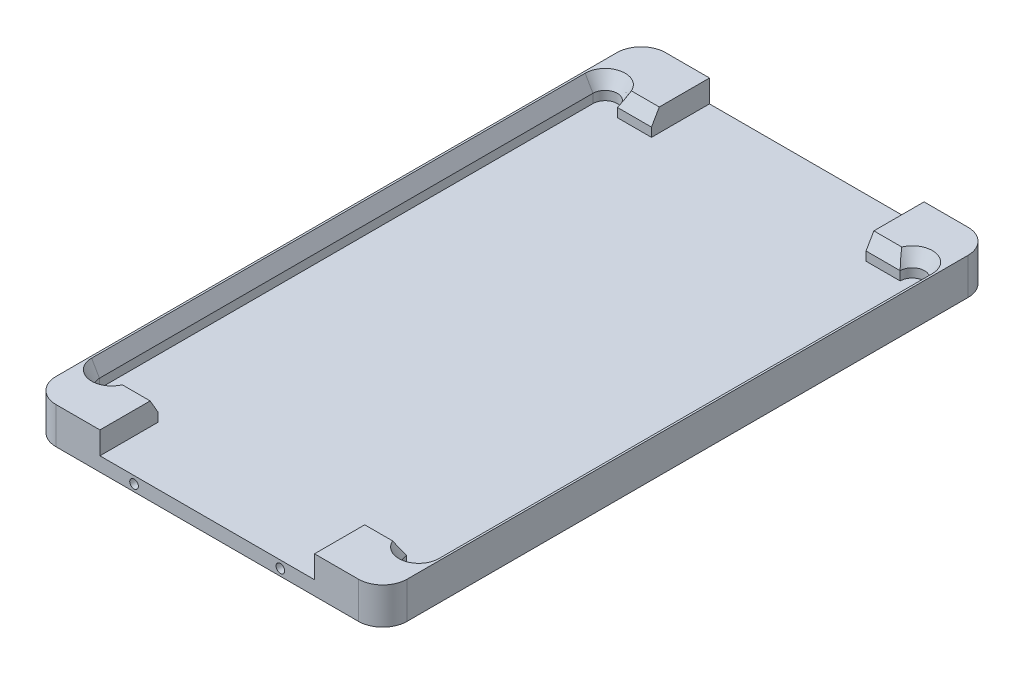
from build123d import *

# Parameters (mm, degrees)
SKETCH1_W                      = 91.44
SKETCH1_H                      = 158.75
BOSS_EXTRUDE1_DEPTH            = 9.525
FILLET1_R                      = 6.35
SKETCH2_W                      = 86.36
SKETCH2_H                      = 128.524
CUT_EXTRUDE1_DEPTH             = 5.842
F_4_40_TAPPED_HOLE1_AT_2_COUNT = 2
F_4_40_TAPPED_HOLE1_AT_2_PITCH = 38.1
SKETCH7_R                      = 3.175
CUT_EXTRUDE2_DEPTH             = 5.842
CHAMFER1_SIZE                  = 2.032
CHAMFER1_SIZE2                 = 3.519527241
CUT_EXTRUDE3_REACH             = 94.095
SKETCH8_W                      = 55.88
SKETCH8_H                      = 158.75


with BuildPart() as part:
    # Sketch1 → Boss-Extrude1 (new body)
    with BuildSketch(Plane(origin=(0, 0, 0), x_dir=(1, 0, 0), z_dir=(0, 1, 0))):
        Rectangle(SKETCH1_W, SKETCH1_H)
    extrude(amount=BOSS_EXTRUDE1_DEPTH)

    # Fillet1
    fillet1_edges = [part.edges().sort_by_distance(p)[0] for p in [
        (45.72, 4.7625, 79.375),
        (-45.72, 4.7625, 79.375),
        (-45.72, 4.7625, -79.375),
        (45.72, 4.7625, -79.375),
    ]]
    fillet(fillet1_edges, radius=FILLET1_R)

    # Sketch2 → Cut-Extrude1 (cut)
    with BuildSketch(Plane(origin=(0, 9.525, 0), x_dir=(1, 0, 0), z_dir=(0, 1, 0))):
        Rectangle(SKETCH2_W, SKETCH2_H)
    extrude(amount=-CUT_EXTRUDE1_DEPTH, mode=Mode.SUBTRACT)

    # Sketch5 → #4-40 Tapped Hole1 (revolve, cut)
    with BuildSketch(Plane(origin=(-19.05, 1.778, 79.375), x_dir=(0, -1, 0), z_dir=(1, 0, 0))):
        Polygon((0, 0), (0, 8.273752758), (1.1303, 7.5946), (1.1303, 0), align=None)
    f_4_40_tapped_hole1 = revolve(axis=Axis((-19.05, 1.778, 85.725), (0, 0, -1)), mode=Mode.SUBTRACT)

    # #4-40 Tapped Hole1 at 2: #4-40 Tapped Hole1 ×2
    with Locations(*[(i * F_4_40_TAPPED_HOLE1_AT_2_PITCH, 0, 0) for i in range(1, F_4_40_TAPPED_HOLE1_AT_2_COUNT)]):
        add(f_4_40_tapped_hole1, mode=Mode.SUBTRACT)

    # Sketch7 → Cut-Extrude2 (cut)
    with BuildSketch(Plane(origin=(0, 9.525, 0), x_dir=(1, 0, 0), z_dir=(0, 1, 0))):
        with Locations((-40.005, 64.262)):
            Circle(SKETCH7_R)
        with Locations((40.005, 64.262)):
            Circle(SKETCH7_R)
        with Locations((-40.005, -64.262)):
            Circle(SKETCH7_R)
        with Locations((40.005, -64.262)):
            Circle(SKETCH7_R)
    extrude(amount=-CUT_EXTRUDE2_DEPTH, mode=Mode.SUBTRACT)

    # Mirror1: #4-40 Tapped Hole1 across plane
    add(f_4_40_tapped_hole1.mirror(Plane.XY), mode=Mode.SUBTRACT)

    # Mirror1 copy 1 sketch → Mirror1 copy 1 (revolve, cut)
    with BuildSketch(Plane(origin=(19.05, 1.778, -79.375), x_dir=(0, -1, 0), z_dir=(1, 0, 0))):
        Polygon((0, 0), (0, -8.273752758), (1.1303, -7.5946), (1.1303, 0), align=None)
    revolve(axis=Axis((19.05, 1.778, -85.725), (0, 0, -1)), mode=Mode.SUBTRACT)

    # Chamfer1
    chamfer1_edges = [part.edges().sort_by_distance(p)[0] for p in [
        (43.18, 9.525, 0),
        (-43.18, 9.525, 0),
        (0, 9.525, -64.262),
        (0, 9.525, 64.262),
        (40.005, 9.525, -67.437),
        (-40.005, 9.525, 67.437),
        (40.005, 9.525, 67.437),
        (-40.005, 9.525, -67.437),
    ]]
    chamfer1_side = [part.faces().sort_by_distance(p)[0] for p in [
        (0, 9.525, -77.542983731),
    ]]
    chamfer(chamfer1_edges, length=CHAMFER1_SIZE, length2=CHAMFER1_SIZE2, reference=chamfer1_side[0])

    # Cut-Extrude3: up to this face of the body (flat: up to its plane)
    cut_extrude3_end = Plane(part.part.faces().sort_by_distance((0, 3.683, 0))[0])
    # Sketch8 → Cut-Extrude3 (cut, up to the picked face)
    with BuildSketch(Plane(origin=(0, 9.525, 0), x_dir=(1, 0, 0), z_dir=(0, 1, 0)), mode=Mode.PRIVATE) as cut_extrude3_sk1:
        Rectangle(SKETCH8_W, SKETCH8_H)
    cut_extrude3_tool1 = split(extrude(cut_extrude3_sk1.sketch, amount=-CUT_EXTRUDE3_REACH, mode=Mode.PRIVATE), bisect_by=cut_extrude3_end, keep=Keep.BOTH, mode=Mode.PRIVATE)
    add(cut_extrude3_tool1.solids().sort_by(Axis((0, 9.525, 0), (0, -1, 0)))[0], mode=Mode.SUBTRACT)


solid = part.part
